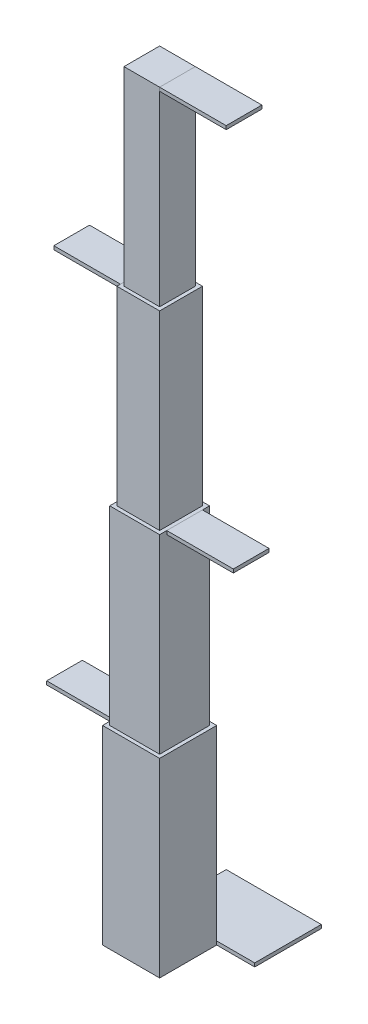
from build123d import *

# Parameters (mm, degrees)
SKETCH1_W            = 95.25
SKETCH1_H            = 95.25
BOSS_EXTRUDE4_DEPTH  = 2032
SKETCH1_8_W          = 114.3
SKETCH1_8_H          = 114.3
BOSS_EXTRUDE5_DEPTH  = 1524
SKETCH1_9_W          = 133.35
SKETCH1_9_H          = 133.35
BOSS_EXTRUDE6_DEPTH  = 1016
SKETCH1_10_W         = 152.4
SKETCH1_10_H         = 152.4
BOSS_EXTRUDE7_DEPTH  = 508
SKETCH2_W            = 95.25
SKETCH2_H            = 9.525
BOSS_EXTRUDE8_DEPTH  = 177.8
SKETCH3_W            = 95.25
SKETCH3_H            = 9.525
BOSS_EXTRUDE9_DEPTH  = 177.8
SKETCH5_W            = 95.25
SKETCH5_H            = 9.525
BOSS_EXTRUDE10_DEPTH = 177.8
SKETCH6_W            = 95.25
SKETCH6_H            = 9.525
BOSS_EXTRUDE11_DEPTH = 177.8
SKETCH7_W            = 254
SKETCH7_H            = 9.525
BOSS_EXTRUDE12_DEPTH = 177.8


with BuildPart() as part:
    # Sketch1 → Boss-Extrude4 (new body)
    with BuildSketch(Plane(origin=(0, 0, 0), x_dir=(1, 0, 0), z_dir=(0, 1, 0))):
        with Locations((76.2, 76.2)):
            Rectangle(SKETCH1_W, SKETCH1_H)
    extrude(amount=BOSS_EXTRUDE4_DEPTH)


with BuildPart() as body_2:
    # Sketch1<8> → Boss-Extrude5 (new body)
    with BuildSketch(Plane(origin=(0, 0, 0), x_dir=(1, 0, 0), z_dir=(0, 1, 0))):
        with Locations((76.2, 76.2)):
            Rectangle(SKETCH1_8_W, SKETCH1_8_H)
    extrude(amount=BOSS_EXTRUDE5_DEPTH)


with BuildPart() as body_3:
    # Sketch1<9> → Boss-Extrude6 (new body)
    with BuildSketch(Plane(origin=(0, 0, 0), x_dir=(1, 0, 0), z_dir=(0, 1, 0))):
        with Locations((76.2, 76.2)):
            Rectangle(SKETCH1_9_W, SKETCH1_9_H)
    extrude(amount=BOSS_EXTRUDE6_DEPTH)


with BuildPart() as body_4:
    # Sketch1<10> → Boss-Extrude7 (new body)
    with BuildSketch(Plane(origin=(0, 0, 0), x_dir=(1, 0, 0), z_dir=(0, 1, 0))):
        with Locations((76.2, 76.2)):
            Rectangle(SKETCH1_10_W, SKETCH1_10_H)
    extrude(amount=BOSS_EXTRUDE7_DEPTH)


with BuildPart() as body_5:
    # Sketch2 → Boss-Extrude8 (new body)
    with BuildSketch(Plane(origin=(123.825, 0, 0), x_dir=(0, 0, -1), z_dir=(1, 0, 0))):
        with Locations((76.2, 2027.2375)):
            Rectangle(SKETCH2_W, SKETCH2_H)
    extrude(amount=BOSS_EXTRUDE8_DEPTH)


with BuildPart() as body_6:
    # Sketch3 → Boss-Extrude9 (new body)
    with BuildSketch(Plane.ZY.offset(-19.05)):
        with Locations((-76.2, 1519.2375)):
            Rectangle(SKETCH3_W, SKETCH3_H)
    extrude(amount=BOSS_EXTRUDE9_DEPTH)


with BuildPart() as body_7:
    # Sketch5 → Boss-Extrude10 (new body)
    with BuildSketch(Plane(origin=(142.875, 0, 0), x_dir=(0, 0, -1), z_dir=(1, 0, 0))):
        with Locations((76.2, 1011.2375)):
            Rectangle(SKETCH5_W, SKETCH5_H)
    extrude(amount=BOSS_EXTRUDE10_DEPTH)


with BuildPart() as body_8:
    # Sketch6 → Boss-Extrude11 (new body)
    with BuildSketch(Plane.ZY):
        with Locations((-76.2, 503.2375)):
            Rectangle(SKETCH6_W, SKETCH6_H)
    extrude(amount=BOSS_EXTRUDE11_DEPTH)


with BuildPart() as body_9:
    # Sketch7 → Boss-Extrude12 (new body)
    with BuildSketch(Plane(origin=(0, 0, -152.4), x_dir=(-1, 0, 0), z_dir=(0, 0, -1))):
        with Locations((-127, 4.7625)):
            Rectangle(SKETCH7_W, SKETCH7_H)
    extrude(amount=BOSS_EXTRUDE12_DEPTH)


solid = Compound([part.part, body_2.part, body_3.part, body_4.part, body_5.part, body_6.part, body_7.part, body_8.part, body_9.part])
